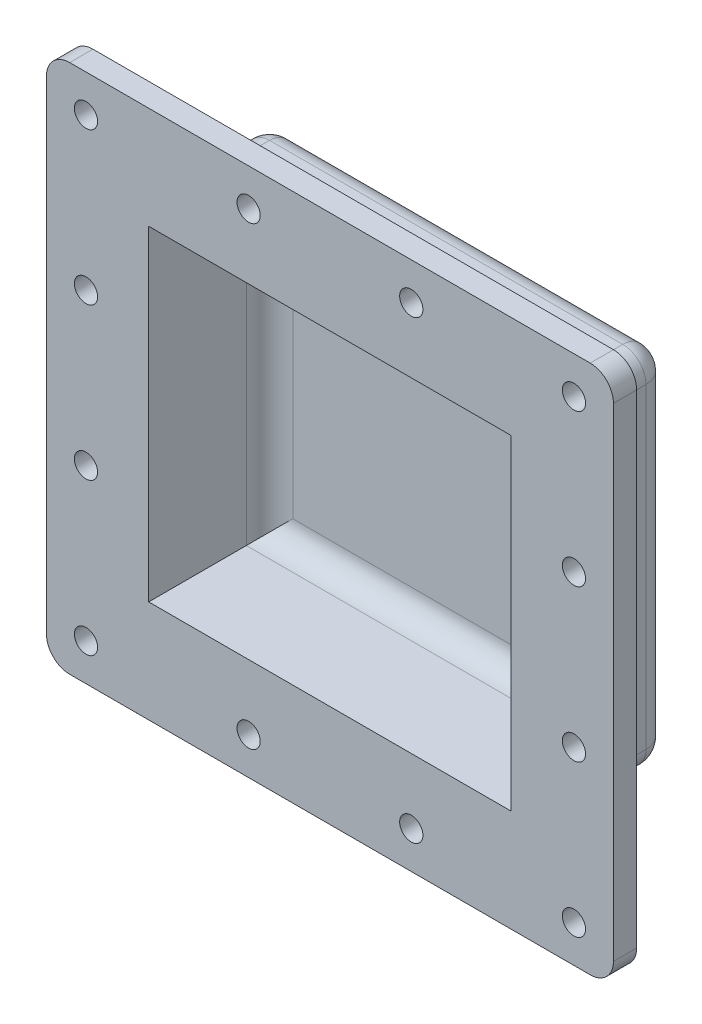
from build123d import *

# Parameters (mm, degrees)
SKETCH1_W           = 43
SKETCH1_H           = 39
BOSS_EXTRUDE1_DEPTH = 12.5
SHELL1_T            = -2
SKETCH2_W           = 61
SKETCH2_H           = 57
SKETCH2_W_2         = 39
SKETCH2_H_2         = 35
BOSS_EXTRUDE2_DEPTH = 2.5
FILLET1_R           = 2.5
FILLET2_R           = 2.5
SKETCH3_W           = 15
SKETCH3_H           = 8
CUT_EXTRUDE1_DEPTH  = 44.720704477
SKETCH4_R           = 1.25
CUT_EXTRUDE2_DEPTH  = 2.5


with BuildPart() as part:
    # Sketch1 → Boss-Extrude1 (new body)
    with BuildSketch(Plane.XY):
        Rectangle(SKETCH1_W, SKETCH1_H)
    extrude(amount=BOSS_EXTRUDE1_DEPTH)

    # Shell1
    shell1_openings = [part.faces().sort_by_distance(p)[0] for p in [
        (0, 0, 12.5),
    ]]
    offset(amount=SHELL1_T, openings=shell1_openings, kind=Kind.INTERSECTION)

    # Sketch2 → Boss-Extrude2 (add)
    with BuildSketch(Plane.XY.offset(12.5)):
        Rectangle(SKETCH2_W, SKETCH2_H)
        Rectangle(SKETCH2_W_2, SKETCH2_H_2, mode=Mode.SUBTRACT)
    extrude(amount=BOSS_EXTRUDE2_DEPTH)

    # Fillet1
    fillet1_edges = [part.edges().sort_by_distance(p)[0] for p in [
        (30.5, -28.5, 13.75),
        (30.5, 28.5, 13.75),
        (-30.5, 28.5, 13.75),
        (-30.5, -28.5, 13.75),
    ]]
    fillet(fillet1_edges, radius=FILLET1_R)

    # Fillet2
    fillet2_edges = [part.edges().sort_by_distance(p)[0] for p in [
        (19.5, 0, 2),
        (0, 17.5, 2),
        (-19.5, 0, 2),
        (0, -17.5, 2),
        (0, -19.5, 0),
        (-21.5, 0, 0),
        (0, 19.5, 0),
        (21.5, 0, 0),
        (21.5, -19.5, 6.25),
        (-21.5, -19.5, 6.25),
        (-21.5, 19.5, 6.25),
        (21.5, 19.5, 6.25),
    ]]
    fillet(fillet2_edges, radius=FILLET2_R)

    # Sketch3 → Cut-Extrude1 (cut, through all)
    with BuildSketch(Plane.XY.offset(2)):
        with Locations((0, 10)):
            Rectangle(SKETCH3_W, SKETCH3_H)
    extrude(amount=-CUT_EXTRUDE1_DEPTH, mode=Mode.SUBTRACT)

    # Sketch4 → Cut-Extrude2 (cut)
    with BuildSketch(Plane.XY.offset(15)):
        with Locations((-26.25, 24.5)):
            Circle(SKETCH4_R)
        with Locations((-8.75, 24.5)):
            Circle(SKETCH4_R)
        with Locations((8.75, 24.5)):
            Circle(SKETCH4_R)
        with Locations((26.25, 24.5)):
            Circle(SKETCH4_R)
        with Locations((26.25, 8.166666667)):
            Circle(SKETCH4_R)
        with Locations((26.25, -8.166666667)):
            Circle(SKETCH4_R)
        with Locations((-8.75, -24.5)):
            Circle(SKETCH4_R)
        with Locations((8.75, -24.5)):
            Circle(SKETCH4_R)
        with Locations((26.25, -24.5)):
            Circle(SKETCH4_R)
        with Locations((-26.25, 8.166666667)):
            Circle(SKETCH4_R)
        with Locations((-26.25, -8.166666667)):
            Circle(SKETCH4_R)
        with Locations((-26.25, -24.5)):
            Circle(SKETCH4_R)
    extrude(amount=-CUT_EXTRUDE2_DEPTH, mode=Mode.SUBTRACT)


solid = part.part
